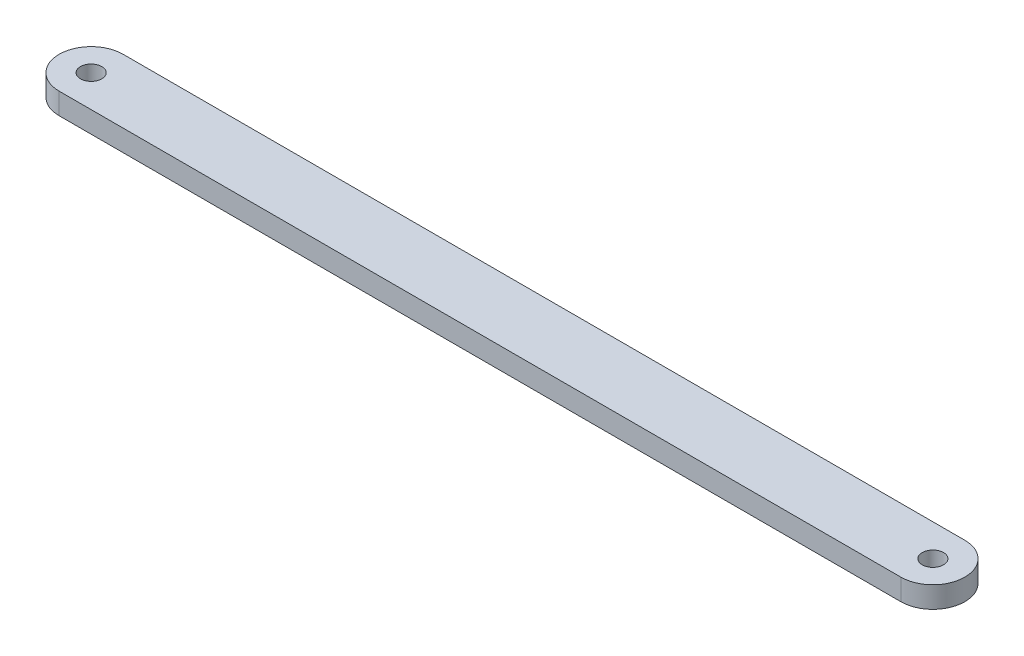
from build123d import *

# Parameters (mm, degrees)
SKETCH2_R           = 5
BOSS_EXTRUDE1_DEPTH = 10


with BuildPart() as part:
    # Sketch2 → Boss-Extrude1 (new body)
    with BuildSketch(Plane(origin=(0, 0, 0), x_dir=(1, 0, 0), z_dir=(0, 1, 0))):
        with BuildLine():
            Line((-197.5, 15), (197.5, 15))
            ThreePointArc((197.5, 15), (212.5, 0), (197.5, -15))
            Line((197.5, -15), (-197.5, -15))
            ThreePointArc((-197.5, -15), (-212.5, 0), (-197.5, 15))
        make_face()
        with Locations(Location((-197.5, 0, 0), (0, 0, 270))):
            Circle(SKETCH2_R, mode=Mode.SUBTRACT)
        with Locations(Location((197.5, 0, 0), (0, 0, 270))):
            Circle(SKETCH2_R, mode=Mode.SUBTRACT)
    extrude(amount=BOSS_EXTRUDE1_DEPTH)


solid = part.part
